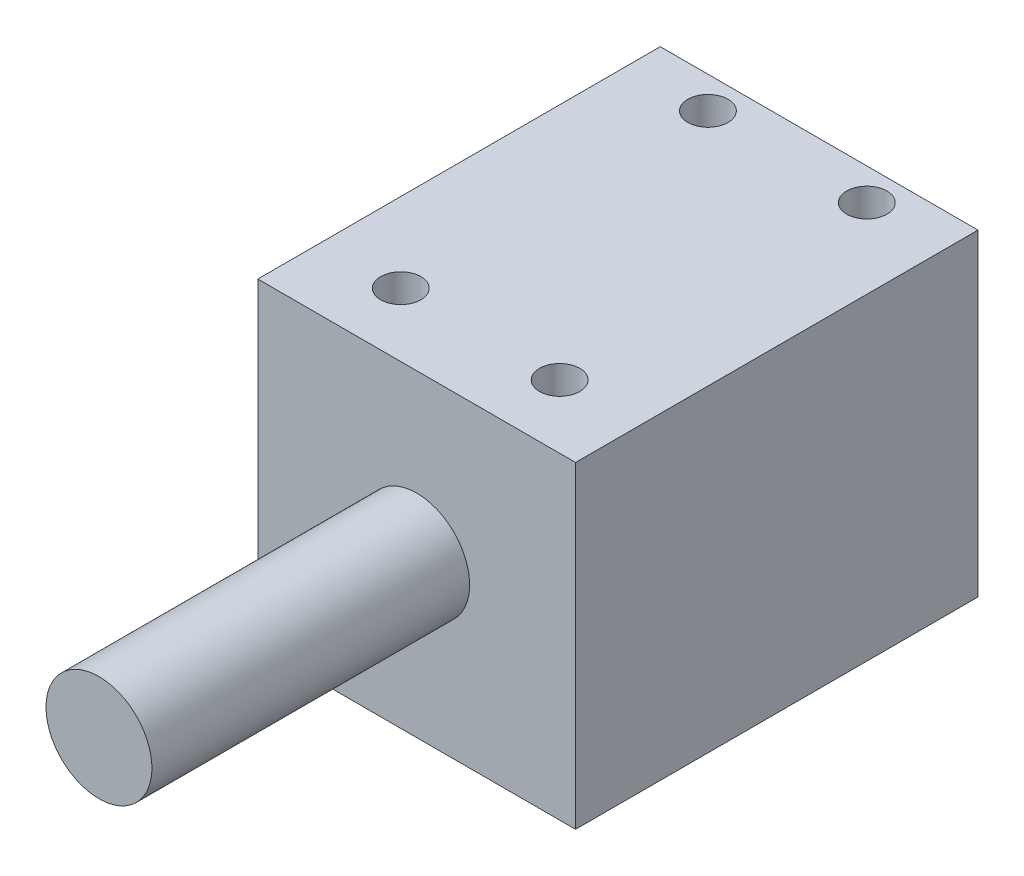
from build123d import *

# Parameters (mm, degrees)
SKETCH3_W           = 38.1
SKETCH3_H           = 38.1
BOSS_EXTRUDE1_DEPTH = 48.26
SKETCH4_R           = 6.35
BOSS_EXTRUDE2_DEPTH = 38.1
SKETCH5_R           = 2.413
CUT_EXTRUDE1_DEPTH  = 10.16


with BuildPart() as part:
    # Sketch3 → Boss-Extrude1 (new body)
    with BuildSketch(Plane.XY):
        Rectangle(SKETCH3_W, SKETCH3_H)
    extrude(amount=-BOSS_EXTRUDE1_DEPTH)

    # Sketch4 → Boss-Extrude2 (add)
    with BuildSketch(Plane.XY):
        with Locations(Location((0, 0, 0), (0, 0, 180))):
            Circle(SKETCH4_R)
    extrude(amount=BOSS_EXTRUDE2_DEPTH)

    # Sketch5 → Cut-Extrude1 (cut)
    with BuildSketch(Plane(origin=(0, 19.05, 0), x_dir=(1, 0, 0), z_dir=(0, 1, 0))):
        with Locations(Location((-9.525, 44.45, 0), (0, 0, 270))):
            Circle(SKETCH5_R)
        with Locations(Location((9.525, 44.45, 0), (0, 0, 270))):
            Circle(SKETCH5_R)
        with Locations(Location((9.525, 7.62, 0), (0, 0, 270))):
            Circle(SKETCH5_R)
        with Locations(Location((-9.525, 7.62, 0), (0, 0, 270))):
            Circle(SKETCH5_R)
    extrude(amount=-CUT_EXTRUDE1_DEPTH, mode=Mode.SUBTRACT)


solid = part.part
